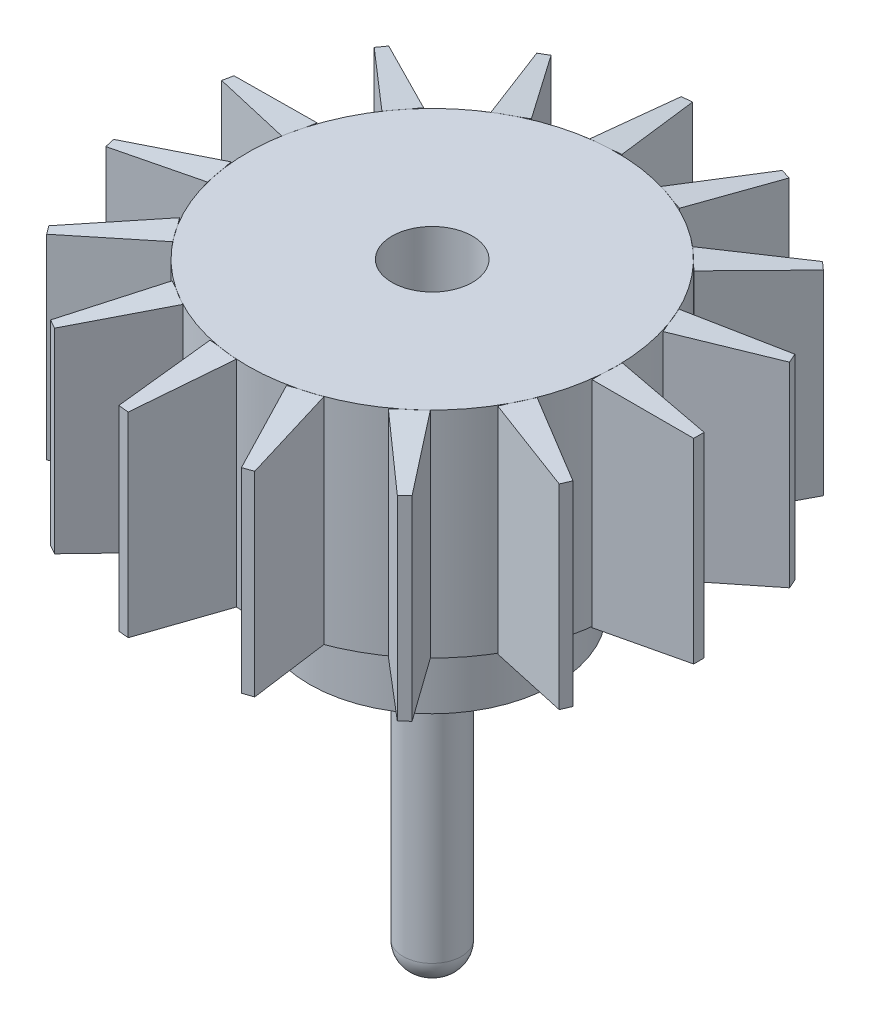
from build123d import *
from build123d.topology import SkipClean

# Parameters (mm, degrees)
SKETCH1_R           = 60.197161107
SKETCH1_R_2         = 40.465282916
BOSS_EXTRUDE1_DEPTH = 70
SKETCH3_W           = 9.709827425
SKETCH3_H           = 70
BOSS_EXTRUDE2_DEPTH = 30
BOSS_EXTRUDE2_TAPER = 6
CIRPATTERN2_COUNT   = 15
CIRPATTERN2_ANGLE   = 337
SKETCH5_R           = 42.646588457
SKETCH5_R_2         = 13.1
BOSS_EXTRUDE3_DEPTH = 70
SKETCH6_R           = 40
BOSS_EXTRUDE4_DEPTH = 30
SKETCH7_R           = 9.525
BOSS_EXTRUDE5_DEPTH = 100
FILLET2_R           = 8


with BuildPart() as part:
    # Sketch1 → Boss-Extrude1 (new body)
    with BuildSketch(Plane(origin=(0, 0, 0), x_dir=(1, 0, 0), z_dir=(0, 1, 0))):
        with Locations(Location((0, 0, 0), (0, 0, 270))):
            Circle(SKETCH1_R)
        with Locations(Location((0, 0, 0), (0, 0, 270))):
            Circle(SKETCH1_R_2, mode=Mode.SUBTRACT)
    extrude(amount=BOSS_EXTRUDE1_DEPTH)

    # Sketch3 → Boss-Extrude2 (add)
    with SkipClean():  # the faces are left unmerged after this step: merging them gives an invalid solid
        with BuildSketch(Plane(origin=(60, 0, 0), x_dir=(0, 0, -1), z_dir=(1, 0, 0))):
            with Locations((-3.089490545, 35)):
                Rectangle(SKETCH3_W, SKETCH3_H)
        boss_extrude2 = extrude(amount=BOSS_EXTRUDE2_DEPTH, taper=BOSS_EXTRUDE2_TAPER)

    # CirPattern2: Boss-Extrude2 ×15 about axis
    cirpattern2_axis = Axis((0, 0, 0), (0, 1, 0))
    for i in range(1, CIRPATTERN2_COUNT):
        add(boss_extrude2.rotate(cirpattern2_axis, i * CIRPATTERN2_ANGLE / (CIRPATTERN2_COUNT - 1)))

    # Sketch5 → Boss-Extrude3 (add)
    with BuildSketch(Plane.XZ):
        Circle(SKETCH5_R)
        with Locations(Location((0, 0, 0), (0, 0, 270))):
            Circle(SKETCH5_R_2, mode=Mode.SUBTRACT)
    extrude(amount=-BOSS_EXTRUDE3_DEPTH)

    # Sketch6 → Boss-Extrude4 (add)
    with BuildSketch(Plane.XZ):
        with Locations(Location((0, 0, 0), (0, 0, 90))):
            Circle(SKETCH6_R)
    extrude(amount=BOSS_EXTRUDE4_DEPTH)

    # Sketch7 → Boss-Extrude5 (add)
    with BuildSketch(Plane.XZ.offset(30)):
        with Locations(Location((0, 0, 0), (0, 0, 270))):
            Circle(SKETCH7_R)
    extrude(amount=BOSS_EXTRUDE5_DEPTH)

    # Fillet2
    fillet2_edges = [part.edges().sort_by_distance(p)[0] for p in [
        (0, -130, 9.525),
    ]]
    fillet(fillet2_edges, radius=FILLET2_R)


solid = part.part
